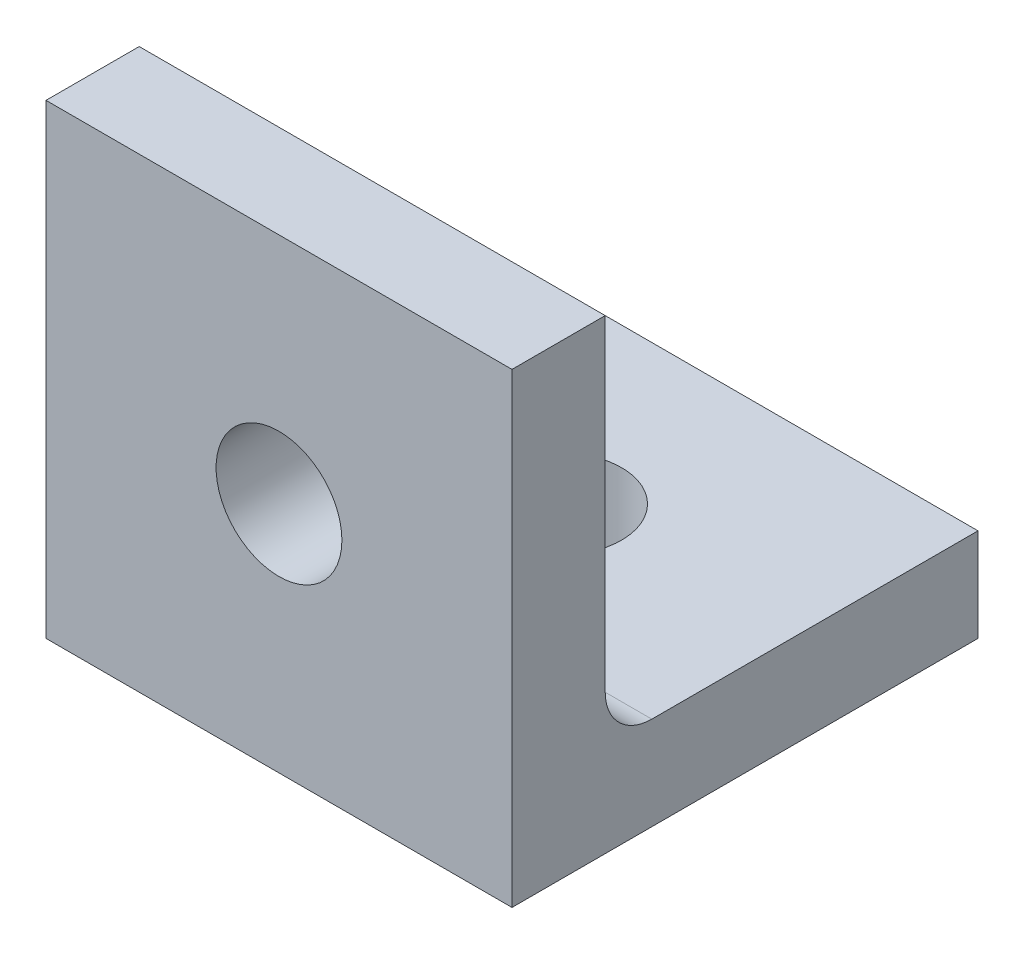
from build123d import *

# Parameters (mm, degrees)
SKETCH1_W           = 25.4
SKETCH1_H           = 25.4
SKETCH1_R           = 3.429
BOSS_EXTRUDE1_DEPTH = 2.54
SKETCH3_W           = 25.4
SKETCH3_H           = 5.08
BOSS_EXTRUDE2_DEPTH = 25.4
SKETCH4_R           = 3.429
CUT_EXTRUDE1_DEPTH  = 5.08
FILLET1_R           = 2.54


with BuildPart() as part:
    # Sketch1 → Boss-Extrude1 (new, symmetric)
    with BuildSketch(Plane.XY):
        with Locations((12.7, -12.7)):
            Rectangle(SKETCH1_W, SKETCH1_H)
        with Locations((12.7, -12.7)):
            Circle(SKETCH1_R, mode=Mode.SUBTRACT)
    extrude(amount=BOSS_EXTRUDE1_DEPTH, both=True)

    # Sketch3 → Boss-Extrude2 (add)
    with BuildSketch(Plane.XY.offset(2.54)):
        with Locations((12.7, -22.86)):
            Rectangle(SKETCH3_W, SKETCH3_H)
    extrude(amount=-BOSS_EXTRUDE2_DEPTH)

    # Sketch4 → Cut-Extrude1 (cut)
    with BuildSketch(Plane(origin=(0, -20.32, 0), x_dir=(1, 0, 0), z_dir=(0, 1, 0))):
        with Locations(Location((12.7, 12.7, 0), (0, 0, 270))):
            Circle(SKETCH4_R)
    extrude(amount=-CUT_EXTRUDE1_DEPTH, mode=Mode.SUBTRACT)

    # Fillet1
    fillet1_edges = [part.edges().sort_by_distance(p)[0] for p in [
        (12.7, -20.32, -2.54),
    ]]
    fillet(fillet1_edges, radius=FILLET1_R)


solid = part.part
